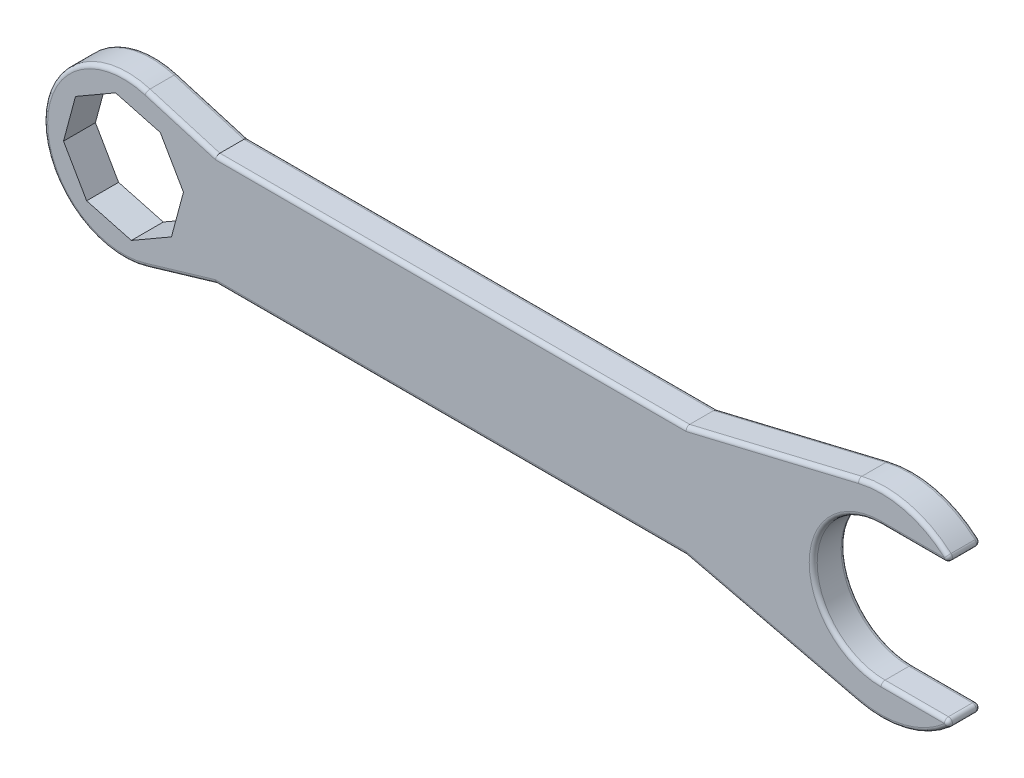
from build123d import *

# Parameters (mm, degrees)
SKETCH1_R               = 10
BOSS_EXTRUDE2_DEPTH     = 2
CUT_EXTRUDE1_DEPTH      = 86.920385669
CUT_EXTRUDE1_DEPTH_BACK = 86.920385669
FILLET1_R               = 0.5
FILLET2_R               = 0.5
FILLET5_R               = 0.5
FILLET6_R               = 0.5
CUT_EXTRUDE4_DEPTH      = 1.5
BOSS_EXTRUDE3_DEPTH     = 1


with BuildPart() as part:
    # Sketch1 → Boss-Extrude2 (new, symmetric)
    with BuildSketch(Plane.XY):
        with BuildLine():
            ThreePointArc((17.084614926, -12.157897989), (7.489010989, 0), (17.084614926, 12.157897989))
            Line((17.084614926, 12.157897989), (-4.483516484, 7.005494505))
            Line((-4.483516484, 7.005494505), (-63.32967033, 7.005494505))
            Line((-63.32967033, 7.005494505), (-72.07886472, 9.59024746))
            ThreePointArc((-72.07886472, 9.59024746), (-66.901712393, 5.986140997), (-64.912087912, 0))
            ThreePointArc((-64.912087912, 0), (-66.901712393, -5.986140997), (-72.07886472, -9.59024746))
            Line((-72.07886472, -9.59024746), (-63.32967033, -7.005494505))
            Line((-63.32967033, -7.005494505), (-4.483516484, -7.005494505))
            Line((-4.483516484, -7.005494505), (17.084614926, -12.157897989))
        make_face()
        with BuildLine():
            ThreePointArc((19.989010989, 8.5), (11.489010989, 0), (19.989010989, -8.5))
            Line((19.989010989, -8.5), (29.154162379, -8.5))
            ThreePointArc((29.154162379, -8.5), (7.489010989, 0), (29.154162379, 8.5))
            Line((29.154162379, 8.5), (19.989010989, 8.5))
        make_face()
        with Locations((-74.912087912, 0)):
            Circle(SKETCH1_R)
    extrude(amount=BOSS_EXTRUDE2_DEPTH, both=True)

    # Sketch3 → Cut-Extrude1 (cut, two sides: drawn at the far end of the back side and taken through both)
    with BuildSketch(Plane.XY.offset(2).offset(-CUT_EXTRUDE1_DEPTH_BACK)):
        Polygon((-75.899774384, 7.512093338), (-80.922339855, 4.613452338), (-82.42418125, -0.987686472), (-79.52554025, -6.010251942), (-73.92440144, -7.512093338), (-68.90183597, -4.613452338), (-67.399994574, 0.987686472), (-70.298635574, 6.010251942), align=None)
    extrude(amount=CUT_EXTRUDE1_DEPTH + CUT_EXTRUDE1_DEPTH_BACK, mode=Mode.SUBTRACT)

    # Fillet1
    fillet1_edges = [part.edges().sort_by_distance(p)[0] for p in [
        (29.154162379, 8.5, 0),
        (29.154162379, -8.5, 0),
    ]]
    fillet(fillet1_edges, radius=FILLET1_R)

    # Fillet2
    fillet2_edges = [part.edges().sort_by_distance(p)[0] for p in [
        (-33.906593407, -7.005494505, -2),
        (-67.704267525, -8.297870983, -2),
        (-84.912087912, 0, -2),
        (-67.704267525, 8.297870983, -2),
        (-33.906593407, 7.005494505, -2),
        (6.300549221, 9.581696247, -2),
        (11.489010989, 0, -2),
        (23.957637956, -8.5, -2),
        (23.010288746, -12.129380888, -2),
        (6.300549221, -9.581696247, -2),
        (23.010288746, 12.129380888, -2),
        (23.957637956, 8.5, -2),
        (28.393972096, -8.823223305, -2),
        (28.393972096, 8.823223305, -2),
    ]]
    fillet(fillet2_edges, radius=FILLET2_R)

    # Fillet5
    fillet5_edges = [part.edges().sort_by_distance(p)[0] for p in [
        (-33.906593407, 7.005494505, 2),
    ]]
    fillet(fillet5_edges, radius=FILLET5_R)

    # Fillet6
    fillet6_edges = [part.edges().sort_by_distance(p)[0] for p in [
        (-66.858036324, 8.047870983, 2),
        (-67.704267525, -8.297870983, 2),
        (6.300549221, -9.581696247, 2),
        (23.010288746, -12.129380888, 2),
        (28.393972096, -8.823223305, 2),
        (23.957637956, -8.5, 2),
        (11.489010989, 0, 2),
        (23.957637956, 8.5, 2),
        (28.393972096, 8.823223305, 2),
        (23.010288746, 12.129380888, 2),
        (-84.912087912, 0, 2),
        (-33.906593407, -7.005494505, 2),
        (5.254040952, 9.331696247, 2),
    ]]
    fillet(fillet6_edges, radius=FILLET6_R)

    # Sketch5 → Cut-Extrude4 (cut, symmetric)
    with BuildSketch(Plane(origin=(0, 0, -2), x_dir=(-1, 0, 0), z_dir=(0, 0, -1))):
        with BuildLine():
            Line((15.761296585, 3.867779807), (35.761532438, 3.867779807))
            ThreePointArc((35.761532438, 3.867779807), (40.475384817, -0.846072572), (35.761532438, -5.559924952))
            Line((35.761532438, -5.559924952), (15.761296585, -5.559924952))
            ThreePointArc((15.761296585, -5.559924952), (11.047444205, -0.846072572), (15.761296585, 3.867779807))
        make_face()
    extrude(amount=CUT_EXTRUDE4_DEPTH, both=True, mode=Mode.SUBTRACT)

    # Sketch6 → Boss-Extrude3 (add)
    with BuildSketch(Plane(origin=(0, 0, -0.5), x_dir=(-1, 0, 0), z_dir=(0, 0, -1))):
        Polygon((14.340044071, 3.5), (14.987179487, 3.5), (14.987179487, 0), (14.673076923, 0), (14.673076923, 3.141025641), (14.134615385, 3.141025641), align=None)
        Polygon((16.512820513, 3.5), (18.666666667, 3.5), (16.826923077, -0.08974359), (16.555588942, 0.059595353), (18.135216346, 3.141025641), (16.512820513, 3.141025641), align=None)
        Polygon((19.048076923, 3.5), (19.410556891, 3.5), (20.326923077, 2.068309295), (21.243289263, 3.5), (21.605769231, 3.5), (20.508513622, 1.78505609), (21.650641026, 0), (21.288161058, 0), (20.326923077, 1.501802885), (19.365685096, 0), (19.003205128, 0), (20.146033654, 1.78505609), align=None)
        Polygon((22.686197917, 3.5), (23.333333333, 3.5), (23.333333333, 0), (23.019230769, 0), (23.019230769, 3.141025641), (22.480769231, 3.141025641), align=None)
        with BuildLine():
            Line((26.833333333, 3.5), (26.833333333, 3.141025641))
            Line((26.833333333, 3.141025641), (25.642828526, 3.141025641))
            Line((25.642828526, 3.141025641), (25.454226763, 2.220452724))
            add(Edge.make_bspline(
                [(25.454226763, 2.220452724), (25.491282637, 2.230682996), (25.563072533, 2.25050253), (25.669032394, 2.2725083), (25.769624597, 2.285773744), (25.834899968, 2.287585055), (25.866486378, 2.288461538)],
                knots=[0, 0, 0, 0, 1.100273476, 2.13160584, 3.095893838, 4, 4, 4, 4], degree=3))
            add(Edge.make_bspline(
                [(25.866486378, 2.288461538), (25.905570118, 2.287615603), (25.982418515, 2.285952282), (26.094857462, 2.269980432), (26.202190355, 2.244840518), (26.304192726, 2.209719996), (26.401053276, 2.164810263), (26.491880838, 2.108710322), (26.578038751, 2.043176991), (26.657981345, 1.967831979), (26.730505653, 1.884910363), (26.794271643, 1.795752492), (26.848434233, 1.701224829), (26.891994988, 1.600424221), (26.926779322, 1.494465067), (26.949931317, 1.382232485), (26.965348026, 1.264784365), (26.967070412, 1.184479795), (26.967948718, 1.143529647)],
                knots=[0, 0, 0, 0, 1.052922333, 2.070308379, 3.05430497, 4.020497103, 4.973039431, 5.925935799, 6.892292201, 7.88610001, 8.88166317, 9.857072816, 10.836096531, 11.812156883, 12.81219415, 13.836441305, 14.89672472, 16, 16, 16, 16], degree=3))
            add(Edge.make_bspline(
                [(26.967948718, 1.143529647), (26.967283643, 1.115007427), (26.96596248, 1.05834844), (26.959243892, 0.974204239), (26.946308176, 0.891841406), (26.928940452, 0.811249014), (26.906398034, 0.732579642), (26.87910898, 0.655608114), (26.845712953, 0.580813507), (26.809081578, 0.507488112), (26.7678351, 0.437289605), (26.722056592, 0.371640618), (26.673691101, 0.309556337), (26.621649716, 0.251702604), (26.56544872, 0.198459586), (26.505768754, 0.149511304), (26.443086035, 0.104029974), (26.376430792, 0.063861779), (26.307288309, 0.026898823), (26.234660092, -0.003424715), (26.160199392, -0.030535243), (26.082834516, -0.05214477), (26.002740703, -0.069077325), (25.919785928, -0.080577925), (25.834405258, -0.088954363), (25.776530245, -0.08947872), (25.747295673, -0.08974359)],
                knots=[0, 0, 0, 0, 1.056347294, 2.098418968, 3.122841568, 4.141288669, 5.149314143, 6.15115421, 7.162517403, 8.180376062, 9.185164535, 10.17417709, 11.141909838, 12.097768115, 13.052685741, 14.0056014, 14.954263652, 15.917497458, 16.885230207, 17.854509472, 18.828990115, 19.81800267, 20.826176721, 21.857883937, 22.917946725, 24, 24, 24, 24], degree=3))
            add(Edge.make_bspline(
                [(25.747295673, -0.08974359), (25.712421492, -0.089052752), (25.643810662, -0.08769361), (25.543290095, -0.073475124), (25.446575489, -0.053111208), (25.354445388, -0.022474938), (25.266074124, 0.015912357), (25.182651406, 0.064428528), (25.10204563, 0.119407632), (25.027533593, 0.184287985), (24.95837748, 0.255203667), (24.896470971, 0.332161308), (24.841337394, 0.41389075), (24.793859647, 0.500788904), (24.753361626, 0.592627435), (24.721546638, 0.689750436), (24.695868283, 0.79165044), (24.685004862, 0.86180395), (24.679487179, 0.897435897)],
                knots=[0, 0, 0, 0, 1.0467383, 2.05933395, 3.04377827, 4.011590433, 4.970194871, 5.932262533, 6.905835911, 7.896367577, 8.894135286, 9.877477877, 10.858688626, 11.851381753, 12.8477658, 13.868841284, 14.917554742, 16, 16, 16, 16], degree=3))
            Line((24.679487179, 0.897435897), (24.993589744, 0.897435897))
            add(Edge.make_bspline(
                [(24.993589744, 0.897435897), (25.001318301, 0.864059445), (25.016173017, 0.79990805), (25.048778766, 0.709776709), (25.088644642, 0.629457485), (25.13604899, 0.557887902), (25.192599021, 0.495478905), (25.257128449, 0.439861843), (25.329476173, 0.389686713), (25.409869402, 0.347863946), (25.494682482, 0.312195193), (25.583449692, 0.288443498), (25.673754038, 0.271742605), (25.734832408, 0.270070844), (25.76552484, 0.269230769)],
                knots=[0, 0, 0, 0, 1.136247022, 2.183929868, 3.172523383, 4.106158343, 5.02341133, 5.958108904, 6.928429099, 7.938127109, 8.96079061, 9.975095812, 10.982467395, 12, 12, 12, 12], degree=3))
            add(Edge.make_bspline(
                [(25.76552484, 0.269230769), (25.795483284, 0.270051547), (25.854471706, 0.271667666), (25.941283093, 0.284106678), (26.025095967, 0.303264249), (26.105083324, 0.331934104), (26.182644864, 0.366778822), (26.255818634, 0.411493898), (26.326721511, 0.462953917), (26.393149645, 0.521910547), (26.453989094, 0.586880241), (26.507745215, 0.656357635), (26.552522128, 0.730474481), (26.590256237, 0.807947634), (26.618909536, 0.889626191), (26.639350517, 0.975127366), (26.651353576, 1.064662347), (26.653004756, 1.125731656), (26.653846154, 1.156850962)],
                knots=[0, 0, 0, 0, 1.027316725, 2.022795036, 3.002884548, 3.971462791, 4.93288096, 5.914575861, 6.907176829, 7.935150275, 8.956128384, 9.956726525, 10.942570165, 11.921478529, 12.907843606, 13.90538589, 14.932640048, 16, 16, 16, 16], degree=3))
            add(Edge.make_bspline(
                [(26.653846154, 1.156850962), (26.653187674, 1.184926713), (26.651898795, 1.239881002), (26.641368224, 1.320280209), (26.623051252, 1.396353251), (26.597627372, 1.468467485), (26.565347864, 1.536690927), (26.525901552, 1.601093987), (26.478548154, 1.660827821), (26.424456265, 1.715920374), (26.365198224, 1.766765249), (26.299754482, 1.810109336), (26.229494555, 1.846573253), (26.155264956, 1.878041252), (26.075300057, 1.900641997), (25.991183425, 1.917609882), (25.902006717, 1.927425245), (25.841036028, 1.928787134), (25.809695513, 1.929487179)],
                knots=[0, 0, 0, 0, 1.045622112, 2.046656509, 3.013763289, 3.955457236, 4.890082067, 5.820317437, 6.762574623, 7.722996705, 8.69280354, 9.665887285, 10.63943826, 11.638615906, 12.663482002, 13.728887084, 14.832589034, 16, 16, 16, 16], degree=3))
            add(Edge.make_bspline(
                [(25.809695513, 1.929487179), (25.782566584, 1.928906588), (25.726552229, 1.927707815), (25.640629402, 1.918881318), (25.550337679, 1.904642024), (25.456023183, 1.885055776), (25.357402675, 1.859424699), (25.254684275, 1.828710199), (25.147652008, 1.7919882), (25.075534284, 1.764255986), (25.038461538, 1.75)],
                knots=[0, 0, 0, 0, 0.817624296, 1.688186739, 2.600797293, 3.572016777, 4.590301741, 5.671205678, 6.80286297, 8, 8, 8, 8], degree=3))
            Line((25.038461538, 1.75), (25.397435897, 3.5))
            Line((25.397435897, 3.5), (26.833333333, 3.5))
        make_face()
        Polygon((27.461538462, 0), (27.923577724, 3.5), (27.968449519, 3.5), (29.413461538, 0.628205128), (30.854967949, 3.5), (30.900540865, 3.5), (31.365384615, 0), (31.049879808, 0), (30.71474359, 2.518429487), (29.451322115, 0), (29.380508814, 0), (28.112179487, 2.524038462), (27.777744391, 0), align=None)
        Polygon((31.903846154, 0), (32.365885417, 3.5), (32.410757212, 3.5), (33.855769231, 0.628205128), (35.297275641, 3.5), (35.342848558, 3.5), (35.807692308, 0), (35.4921875, 0), (35.157051282, 2.518429487), (33.893629808, 0), (33.822816506, 0), (32.554487179, 2.524038462), (32.220052083, 0), align=None)
    extrude(amount=BOSS_EXTRUDE3_DEPTH)


solid = part.part
